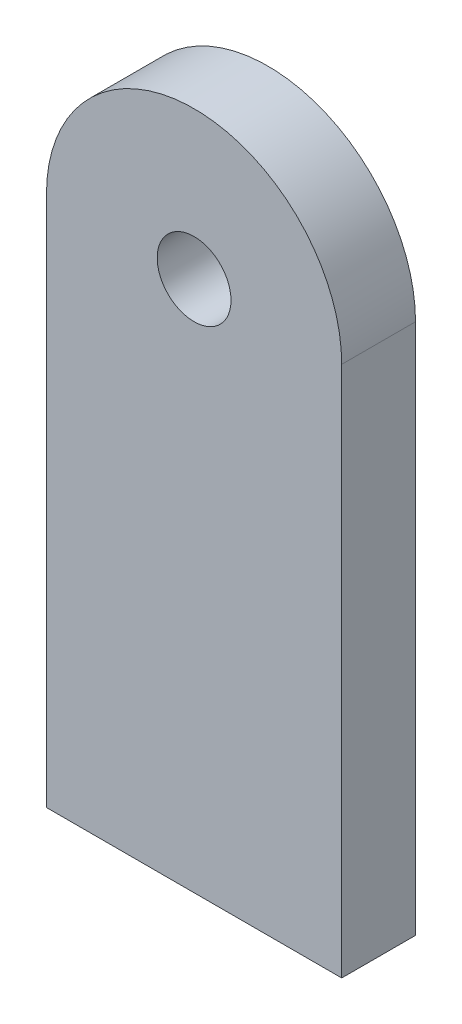
from build123d import *

# Parameters (mm, degrees)
SKETCH1_R           = 12.5
BOSS_EXTRUDE1_DEPTH = 25


with BuildPart() as part:
    # Sketch1 → Boss-Extrude1 (new body)
    with BuildSketch(Plane.XY):
        with BuildLine():
            Line((0, 0), (100, 0))
            Line((100, 0), (100, 180))
            ThreePointArc((100, 180), (50, 230), (0, 180))
            Line((0, 180), (0, 0))
        make_face()
        with Locations((50, 180)):
            Circle(SKETCH1_R, mode=Mode.SUBTRACT)
    extrude(amount=BOSS_EXTRUDE1_DEPTH)


solid = part.part
